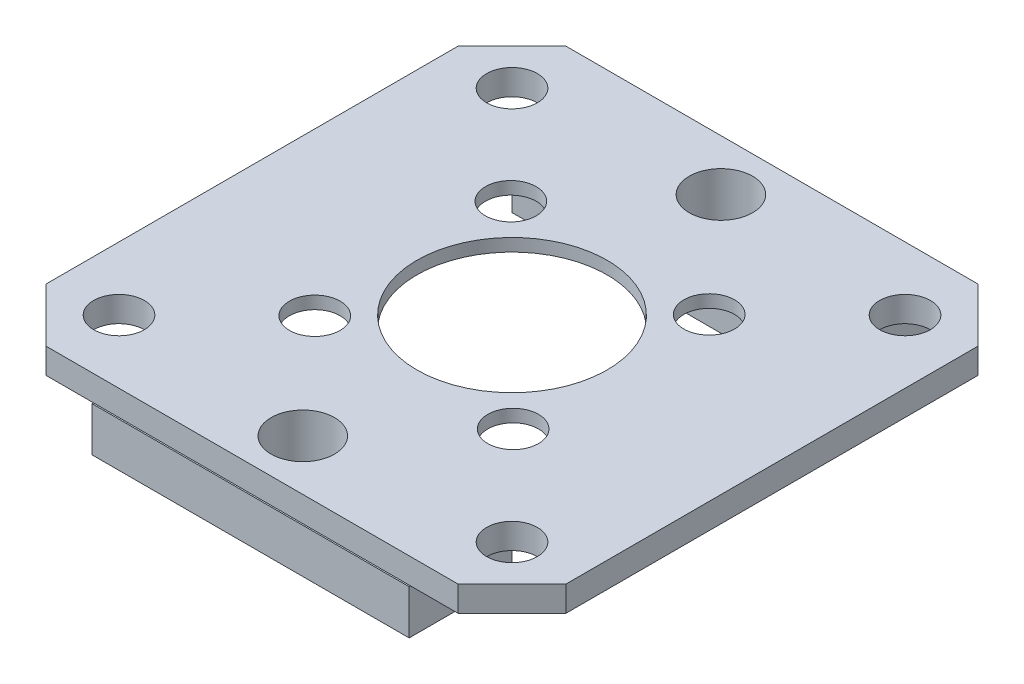
from build123d import *

# Parameters (mm, degrees)
SKETCH2_W           = 41
SKETCH2_H           = 41
BOSS_EXTRUDE1_DEPTH = 2
SKETCH3_R           = 2
CUT_EXTRUDE1_DEPTH  = 30.060282173
SKETCH4_R           = 7.5
CUT_EXTRUDE2_DEPTH  = 30.060282173
SKETCH5_W           = 25
SKETCH5_H           = 25
CUT_EXTRUDE3_DEPTH  = 1
CUT_EXTRUDE4_DEPTH  = 30.060282173
SKETCH7_R           = 2
CUT_EXTRUDE5_DEPTH  = 30.060282173
SKETCH8_W           = 25
SKETCH8_H           = 8.111036271
SKETCH8_H_2         = 7.957817611
BOSS_EXTRUDE2_DEPTH = 3.5
SKETCH9_R           = 2.5
CUT_EXTRUDE6_DEPTH  = 30.585719801


with BuildPart() as part:
    # Sketch2 → Boss-Extrude1 (new body)
    with BuildSketch(Plane(origin=(0, 0, 0), x_dir=(1, 0, 0), z_dir=(0, 1, 0))):
        Rectangle(SKETCH2_W, SKETCH2_H)
    extrude(amount=BOSS_EXTRUDE1_DEPTH)

    # Sketch3 → Cut-Extrude1 (cut, through all)
    with BuildSketch(Plane.XZ):
        with Locations(Location((-7.732300971, 7.823779246, 0), (0, 0, 270))):
            Circle(SKETCH3_R)
        with Locations(Location((7.823779246, 7.732300971, 0), (0, 0, 270))):
            Circle(SKETCH3_R)
        with Locations(Location((7.732300971, -7.823779246, 0), (0, 0, 270))):
            Circle(SKETCH3_R)
        with Locations(Location((-7.823779246, -7.732300971, 0), (0, 0, 270))):
            Circle(SKETCH3_R)
    extrude(amount=-CUT_EXTRUDE1_DEPTH, mode=Mode.SUBTRACT)

    # Sketch4 → Cut-Extrude2 (cut, through all)
    with BuildSketch(Plane(origin=(0, 2, 0), x_dir=(1, 0, 0), z_dir=(0, 1, 0))):
        with Locations(Location((0, 0, 0), (0, 0, 270))):
            Circle(SKETCH4_R)
    extrude(amount=-CUT_EXTRUDE2_DEPTH, mode=Mode.SUBTRACT)

    # Sketch5 → Cut-Extrude3 (cut)
    with BuildSketch(Plane.XZ):
        Rectangle(SKETCH5_W, SKETCH5_H)
    extrude(amount=-CUT_EXTRUDE3_DEPTH, mode=Mode.SUBTRACT)

    # Sketch6 → Cut-Extrude4 (cut, through all)
    with BuildSketch(Plane(origin=(0, 2, 0), x_dir=(1, 0, 0), z_dir=(0, 1, 0))):
        Polygon((-20.5, 16.257359313), (-16.257359313, 20.5), (-20.5, 20.5), align=None)
        Polygon((16.257359313, 20.5), (20.5, 16.257359313), (20.5, 20.5), align=None)
        Polygon((20.5, -16.257359313), (16.257359313, -20.5), (20.5, -20.5), align=None)
        Polygon((-16.257359313, -20.5), (-20.5, -16.257359313), (-20.5, -20.5), align=None)
    extrude(amount=-CUT_EXTRUDE4_DEPTH, mode=Mode.SUBTRACT)

    # Sketch7 → Cut-Extrude5 (cut, through all)
    with BuildSketch(Plane.XZ):
        with Locations(Location((-15.5, 15.5, 0), (0, 0, 270))):
            Circle(SKETCH7_R)
        with Locations(Location((15.5, 15.5, 0), (0, 0, 270))):
            Circle(SKETCH7_R)
        with Locations(Location((15.5, -15.5, 0), (0, 0, 270))):
            Circle(SKETCH7_R)
        with Locations(Location((-15.5, -15.5, 0), (0, 0, 270))):
            Circle(SKETCH7_R)
    extrude(amount=-CUT_EXTRUDE5_DEPTH, mode=Mode.SUBTRACT)

    # Sketch8 → Boss-Extrude2 (add)
    with BuildSketch(Plane.XZ):
        with Locations((0, 16.555518136)):
            Rectangle(SKETCH8_W, SKETCH8_H)
        with Locations((0, -16.478908806)):
            Rectangle(SKETCH8_W, SKETCH8_H_2)
    extrude(amount=BOSS_EXTRUDE2_DEPTH)

    # Sketch9 → Cut-Extrude6 (cut, through all)
    with BuildSketch(Plane.XZ.offset(3.5)):
        with Locations(Location((0, 16.5, 0), (0, 0, 270))):
            Circle(SKETCH9_R)
        with Locations(Location((0, -16.478908806, 0), (0, 0, 270))):
            Circle(SKETCH9_R)
    extrude(amount=-CUT_EXTRUDE6_DEPTH, mode=Mode.SUBTRACT)


solid = part.part
